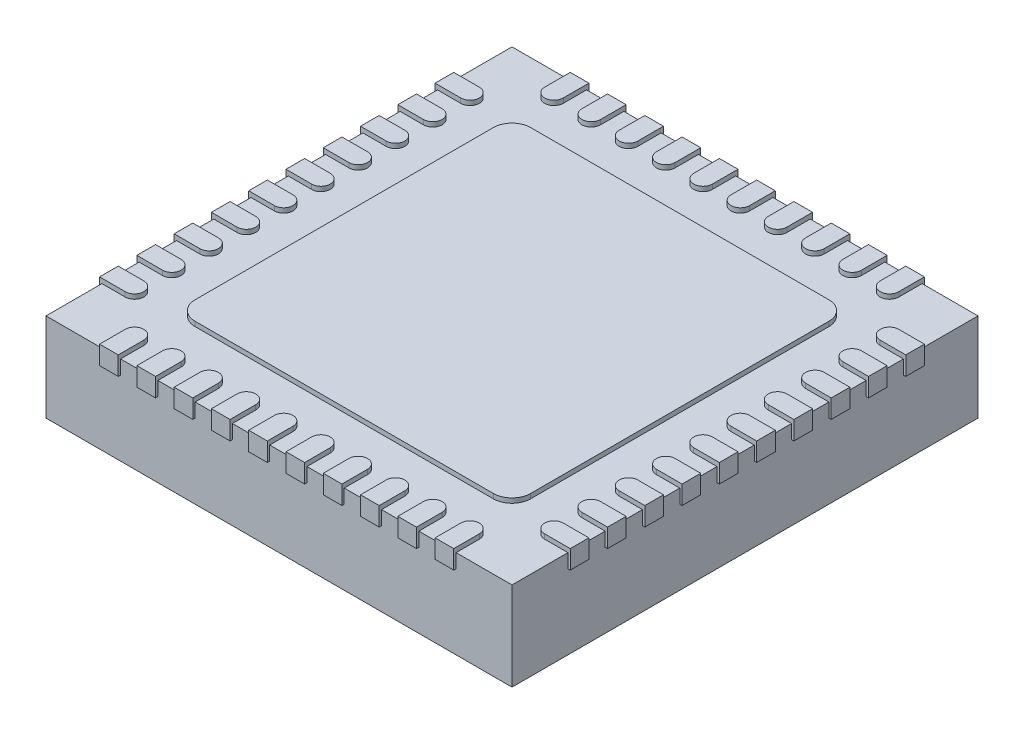
from build123d import *

# Parameters (mm, degrees)
SKETCH3_W                = 5
SKETCH3_H                = 5
BOSS_EXTRUDE2_DEPTH      = 0.95
BOSS_EXTRUDE3_DEPTH      = 0.05
BOSS_EXTRUDE3_DEPTH_BACK = 0.15
SKETCH7_R                = 0.3
CUT_EXTRUDE3_DEPTH       = 0.1
ENL_V_MAT_EXTRU_1_DEPTH  = 0.1


with BuildPart() as part:
    # Sketch3 → Boss-Extrude2 (new body)
    with BuildSketch(Plane(origin=(0, 0, 0), x_dir=(1, 0, 0), z_dir=(0, 1, 0))):
        Rectangle(SKETCH3_W, SKETCH3_H)
    extrude(amount=-BOSS_EXTRUDE2_DEPTH)

    # Sketch2 → Boss-Extrude3 (add, two sides: drawn at the far end of the back side and taken through both)
    with BuildSketch(Plane(origin=(0, 0, 0), x_dir=(1, 0, 0), z_dir=(0, 1, 0)).offset(-BOSS_EXTRUDE3_DEPTH_BACK)):
        with BuildLine():
            Line((-1.6, -1.8), (1.6, -1.8))
            ThreePointArc((1.6, -1.8), (1.741421356, -1.741421356), (1.8, -1.6))
            Line((1.8, -1.6), (1.8, 1.6))
            ThreePointArc((1.8, 1.6), (1.741421356, 1.741421356), (1.6, 1.8))
            Line((1.6, 1.8), (-1.6, 1.8))
            ThreePointArc((-1.6, 1.8), (-1.741421356, 1.741421356), (-1.8, 1.6))
            Line((-1.8, 1.6), (-1.8, -1.6))
            ThreePointArc((-1.8, -1.6), (-1.741421356, -1.741421356), (-1.6, -1.8))
        make_face()
        with BuildLine():
            Line((-1.9, -2.25), (-1.9, -2.525))
            Line((-1.9, -2.525), (-1.7, -2.525))
            Line((-1.7, -2.525), (-1.7, -2.25))
            ThreePointArc((-1.7, -2.25), (-1.8, -2.15), (-1.9, -2.25))
        make_face()
        with BuildLine():
            Line((1.3, -2.25), (1.3, -2.525))
            Line((1.3, -2.525), (1.5, -2.525))
            Line((1.5, -2.525), (1.5, -2.25))
            ThreePointArc((1.5, -2.25), (1.4, -2.15), (1.3, -2.25))
        make_face()
        with BuildLine():
            Line((-1.9, 2.25), (-1.9, 2.525))
            Line((-1.9, 2.525), (-1.7, 2.525))
            Line((-1.7, 2.525), (-1.7, 2.25))
            ThreePointArc((-1.7, 2.25), (-1.8, 2.15), (-1.9, 2.25))
        make_face()
        with BuildLine():
            Line((-1.5, -2.25), (-1.5, -2.525))
            Line((-1.5, -2.525), (-1.3, -2.525))
            Line((-1.3, -2.525), (-1.3, -2.25))
            ThreePointArc((-1.3, -2.25), (-1.4, -2.15), (-1.5, -2.25))
        make_face()
        with BuildLine():
            Line((-1.3, 2.525), (-1.3, 2.25))
            ThreePointArc((-1.3, 2.25), (-1.4, 2.15), (-1.5, 2.25))
            Line((-1.5, 2.25), (-1.5, 2.525))
            Line((-1.5, 2.525), (-1.3, 2.525))
        make_face()
        with BuildLine():
            Line((-1.1, -2.25), (-1.1, -2.525))
            Line((-1.1, -2.525), (-0.9, -2.525))
            Line((-0.9, -2.525), (-0.9, -2.25))
            ThreePointArc((-0.9, -2.25), (-1, -2.15), (-1.1, -2.25))
        make_face()
        with BuildLine():
            Line((-0.9, 2.525), (-0.9, 2.25))
            ThreePointArc((-0.9, 2.25), (-1, 2.15), (-1.1, 2.25))
            Line((-1.1, 2.25), (-1.1, 2.525))
            Line((-1.1, 2.525), (-0.9, 2.525))
        make_face()
        with BuildLine():
            Line((-0.7, -2.25), (-0.7, -2.525))
            Line((-0.7, -2.525), (-0.5, -2.525))
            Line((-0.5, -2.525), (-0.5, -2.25))
            ThreePointArc((-0.5, -2.25), (-0.6, -2.15), (-0.7, -2.25))
        make_face()
        with BuildLine():
            Line((-0.5, 2.525), (-0.5, 2.25))
            ThreePointArc((-0.5, 2.25), (-0.6, 2.15), (-0.7, 2.25))
            Line((-0.7, 2.25), (-0.7, 2.525))
            Line((-0.7, 2.525), (-0.5, 2.525))
        make_face()
        with BuildLine():
            Line((-0.3, -2.25), (-0.3, -2.525))
            Line((-0.3, -2.525), (-0.1, -2.525))
            Line((-0.1, -2.525), (-0.1, -2.25))
            ThreePointArc((-0.1, -2.25), (-0.2, -2.15), (-0.3, -2.25))
        make_face()
        with BuildLine():
            Line((-0.1, 2.525), (-0.1, 2.25))
            ThreePointArc((-0.1, 2.25), (-0.2, 2.15), (-0.3, 2.25))
            Line((-0.3, 2.25), (-0.3, 2.525))
            Line((-0.3, 2.525), (-0.1, 2.525))
        make_face()
        with BuildLine():
            Line((0.1, -2.25), (0.1, -2.525))
            Line((0.1, -2.525), (0.3, -2.525))
            Line((0.3, -2.525), (0.3, -2.25))
            ThreePointArc((0.3, -2.25), (0.2, -2.15), (0.1, -2.25))
        make_face()
        with BuildLine():
            Line((0.3, 2.525), (0.3, 2.25))
            ThreePointArc((0.3, 2.25), (0.2, 2.15), (0.1, 2.25))
            Line((0.1, 2.25), (0.1, 2.525))
            Line((0.1, 2.525), (0.3, 2.525))
        make_face()
        with BuildLine():
            Line((0.5, -2.25), (0.5, -2.525))
            Line((0.5, -2.525), (0.7, -2.525))
            Line((0.7, -2.525), (0.7, -2.25))
            ThreePointArc((0.7, -2.25), (0.6, -2.15), (0.5, -2.25))
        make_face()
        with BuildLine():
            Line((0.7, 2.525), (0.7, 2.25))
            ThreePointArc((0.7, 2.25), (0.6, 2.15), (0.5, 2.25))
            Line((0.5, 2.25), (0.5, 2.525))
            Line((0.5, 2.525), (0.7, 2.525))
        make_face()
        with BuildLine():
            Line((0.9, -2.25), (0.9, -2.525))
            Line((0.9, -2.525), (1.1, -2.525))
            Line((1.1, -2.525), (1.1, -2.25))
            ThreePointArc((1.1, -2.25), (1, -2.15), (0.9, -2.25))
        make_face()
        with BuildLine():
            Line((1.1, 2.525), (1.1, 2.25))
            ThreePointArc((1.1, 2.25), (1, 2.15), (0.9, 2.25))
            Line((0.9, 2.25), (0.9, 2.525))
            Line((0.9, 2.525), (1.1, 2.525))
        make_face()
        with BuildLine():
            Line((-2.525, -1.9), (-2.25, -1.9))
            ThreePointArc((-2.25, -1.9), (-2.15, -1.8), (-2.25, -1.7))
            Line((-2.25, -1.7), (-2.525, -1.7))
            Line((-2.525, -1.7), (-2.525, -1.9))
        make_face()
        with BuildLine():
            Line((1.5, 2.525), (1.5, 2.25))
            ThreePointArc((1.5, 2.25), (1.4, 2.15), (1.3, 2.25))
            Line((1.3, 2.25), (1.3, 2.525))
            Line((1.3, 2.525), (1.5, 2.525))
        make_face()
        with BuildLine():
            Line((2.25, -1.9), (2.525, -1.9))
            Line((2.525, -1.9), (2.525, -1.7))
            Line((2.525, -1.7), (2.25, -1.7))
            ThreePointArc((2.25, -1.7), (2.15, -1.8), (2.25, -1.9))
        make_face()
        with BuildLine():
            Line((-2.25, -1.3), (-2.525, -1.3))
            Line((-2.525, -1.3), (-2.525, -1.5))
            Line((-2.525, -1.5), (-2.25, -1.5))
            ThreePointArc((-2.25, -1.5), (-2.15, -1.4), (-2.25, -1.3))
        make_face()
        with BuildLine():
            Line((2.25, -1.5), (2.525, -1.5))
            Line((2.525, -1.5), (2.525, -1.3))
            Line((2.525, -1.3), (2.25, -1.3))
            ThreePointArc((2.25, -1.3), (2.15, -1.4), (2.25, -1.5))
        make_face()
        with BuildLine():
            Line((-2.25, -0.9), (-2.525, -0.9))
            Line((-2.525, -0.9), (-2.525, -1.1))
            Line((-2.525, -1.1), (-2.25, -1.1))
            ThreePointArc((-2.25, -1.1), (-2.15, -1), (-2.25, -0.9))
        make_face()
        with BuildLine():
            Line((2.25, -1.1), (2.525, -1.1))
            Line((2.525, -1.1), (2.525, -0.9))
            Line((2.525, -0.9), (2.25, -0.9))
            ThreePointArc((2.25, -0.9), (2.15, -1), (2.25, -1.1))
        make_face()
        with BuildLine():
            Line((-2.25, -0.5), (-2.525, -0.5))
            Line((-2.525, -0.5), (-2.525, -0.7))
            Line((-2.525, -0.7), (-2.25, -0.7))
            ThreePointArc((-2.25, -0.7), (-2.15, -0.6), (-2.25, -0.5))
        make_face()
        with BuildLine():
            Line((2.25, -0.7), (2.525, -0.7))
            Line((2.525, -0.7), (2.525, -0.5))
            Line((2.525, -0.5), (2.25, -0.5))
            ThreePointArc((2.25, -0.5), (2.15, -0.6), (2.25, -0.7))
        make_face()
        with BuildLine():
            Line((-2.25, -0.1), (-2.525, -0.1))
            Line((-2.525, -0.1), (-2.525, -0.3))
            Line((-2.525, -0.3), (-2.25, -0.3))
            ThreePointArc((-2.25, -0.3), (-2.15, -0.2), (-2.25, -0.1))
        make_face()
        with BuildLine():
            Line((2.25, -0.3), (2.525, -0.3))
            Line((2.525, -0.3), (2.525, -0.1))
            Line((2.525, -0.1), (2.25, -0.1))
            ThreePointArc((2.25, -0.1), (2.15, -0.2), (2.25, -0.3))
        make_face()
        with BuildLine():
            Line((-2.25, 0.3), (-2.525, 0.3))
            Line((-2.525, 0.3), (-2.525, 0.1))
            Line((-2.525, 0.1), (-2.25, 0.1))
            ThreePointArc((-2.25, 0.1), (-2.15, 0.2), (-2.25, 0.3))
        make_face()
        with BuildLine():
            Line((2.25, 0.1), (2.525, 0.1))
            Line((2.525, 0.1), (2.525, 0.3))
            Line((2.525, 0.3), (2.25, 0.3))
            ThreePointArc((2.25, 0.3), (2.15, 0.2), (2.25, 0.1))
        make_face()
        with BuildLine():
            Line((-2.25, 0.7), (-2.525, 0.7))
            Line((-2.525, 0.7), (-2.525, 0.5))
            Line((-2.525, 0.5), (-2.25, 0.5))
            ThreePointArc((-2.25, 0.5), (-2.15, 0.6), (-2.25, 0.7))
        make_face()
        with BuildLine():
            Line((2.25, 0.5), (2.525, 0.5))
            Line((2.525, 0.5), (2.525, 0.7))
            Line((2.525, 0.7), (2.25, 0.7))
            ThreePointArc((2.25, 0.7), (2.15, 0.6), (2.25, 0.5))
        make_face()
        with BuildLine():
            Line((-2.25, 1.1), (-2.525, 1.1))
            Line((-2.525, 1.1), (-2.525, 0.9))
            Line((-2.525, 0.9), (-2.25, 0.9))
            ThreePointArc((-2.25, 0.9), (-2.15, 1), (-2.25, 1.1))
        make_face()
        with BuildLine():
            Line((2.25, 0.9), (2.525, 0.9))
            Line((2.525, 0.9), (2.525, 1.1))
            Line((2.525, 1.1), (2.25, 1.1))
            ThreePointArc((2.25, 1.1), (2.15, 1), (2.25, 0.9))
        make_face()
        with BuildLine():
            Line((1.7, -2.25), (1.7, -2.525))
            Line((1.7, -2.525), (1.9, -2.525))
            Line((1.9, -2.525), (1.9, -2.25))
            ThreePointArc((1.9, -2.25), (1.8, -2.15), (1.7, -2.25))
        make_face()
        with BuildLine():
            Line((1.9, 2.525), (1.9, 2.25))
            ThreePointArc((1.9, 2.25), (1.8, 2.15), (1.7, 2.25))
            Line((1.7, 2.25), (1.7, 2.525))
            Line((1.7, 2.525), (1.9, 2.525))
        make_face()
        with BuildLine():
            Line((-2.25, 1.5), (-2.525, 1.5))
            Line((-2.525, 1.5), (-2.525, 1.3))
            Line((-2.525, 1.3), (-2.25, 1.3))
            ThreePointArc((-2.25, 1.3), (-2.15, 1.4), (-2.25, 1.5))
        make_face()
        with BuildLine():
            Line((2.25, 1.3), (2.525, 1.3))
            Line((2.525, 1.3), (2.525, 1.5))
            Line((2.525, 1.5), (2.25, 1.5))
            ThreePointArc((2.25, 1.5), (2.15, 1.4), (2.25, 1.3))
        make_face()
        with BuildLine():
            Line((-2.25, 1.9), (-2.525, 1.9))
            Line((-2.525, 1.9), (-2.525, 1.7))
            Line((-2.525, 1.7), (-2.25, 1.7))
            ThreePointArc((-2.25, 1.7), (-2.15, 1.8), (-2.25, 1.9))
        make_face()
        with BuildLine():
            Line((2.25, 1.7), (2.525, 1.7))
            Line((2.525, 1.7), (2.525, 1.9))
            Line((2.525, 1.9), (2.25, 1.9))
            ThreePointArc((2.25, 1.9), (2.15, 1.8), (2.25, 1.7))
        make_face()
    extrude(amount=BOSS_EXTRUDE3_DEPTH + BOSS_EXTRUDE3_DEPTH_BACK)

    # Sketch7 → Cut-Extrude3 (cut)
    with BuildSketch(Plane.XZ.offset(0.95)):
        with Locations(Location((2.05, -2.05, 0), (0, 0, 270))):
            Circle(SKETCH7_R)
    extrude(amount=-CUT_EXTRUDE3_DEPTH, mode=Mode.SUBTRACT)

    # Esquisse1 → Enlèv. mat.-Extru.1 (cut)
    # profile 1 of 7: a face of its own
    with BuildSketch(Plane(origin=(0, -0.95, 0), x_dir=(-1, 0, 0), z_dir=(0, -1, 0))):
        with BuildLine():
            Line((-1.864407441, 0.657456142), (-1.705562038, 0.657456142))
            add(Edge.make_bspline(
                [(-1.705562038, 0.657456142), (-1.694961818, 0.657420858), (-1.674608221, 0.657353107), (-1.64544964, 0.656975336), (-1.618954923, 0.65589258), (-1.595137924, 0.654960812), (-1.573999079, 0.653261747), (-1.555473569, 0.651637815), (-1.539646716, 0.649512002), (-1.53006596, 0.647537737), (-1.525728054, 0.646643843)],
                knots=[0, 0, 0, 0, 1.410062039, 2.707475311, 3.878576406, 4.937260626, 5.877586885, 6.699081471, 7.410979367, 8, 8, 8, 8], degree=3))
            add(Edge.make_bspline(
                [(-1.525728054, 0.646643843), (-1.519920837, 0.645209023), (-1.508430288, 0.642369991), (-1.491886255, 0.636369332), (-1.4761214, 0.629425238), (-1.461201207, 0.62126918), (-1.447200412, 0.611840614), (-1.433974652, 0.601302308), (-1.421463913, 0.589711924), (-1.41017415, 0.576777237), (-1.399529044, 0.563207171), (-1.390550909, 0.548533283), (-1.382811511, 0.533188615), (-1.376649626, 0.517017112), (-1.371688014, 0.500175603), (-1.368189563, 0.482511536), (-1.366091526, 0.464105387), (-1.365877927, 0.451551004), (-1.36576962, 0.445185259)],
                knots=[0, 0, 0, 0, 1.027469482, 2.033020251, 3.019912614, 3.986113645, 4.951240523, 5.91722682, 6.890402269, 7.87763091, 8.8651537, 9.85103654, 10.82876324, 11.815024772, 12.821070561, 13.842952187, 14.906261191, 16, 16, 16, 16], degree=3))
            add(Edge.make_bspline(
                [(-1.36576962, 0.445185259), (-1.366102768, 0.434609084), (-1.366752826, 0.413972226), (-1.372813698, 0.384022705), (-1.382741587, 0.356085128), (-1.396422047, 0.330194672), (-1.413843607, 0.306856008), (-1.43478155, 0.286356744), (-1.459247559, 0.269202693), (-1.482023493, 0.257307146), (-1.502142606, 0.249688754), (-1.518705518, 0.244328366), (-1.53677285, 0.240186813), (-1.556171496, 0.236476569), (-1.576982182, 0.233675381), (-1.59915503, 0.231623742), (-1.622705854, 0.230341485), (-1.638884536, 0.23015053), (-1.647207421, 0.230052296)],
                knots=[0, 0, 0, 0, 1.260483769, 2.459530307, 3.627416485, 4.787058657, 5.939039949, 7.08810263, 8.267026773, 9.491475466, 10.141966685, 10.831826277, 11.566392101, 12.351337768, 13.187381173, 14.07005841, 15.007169909, 16, 16, 16, 16], degree=3))
            Line((-1.647207421, 0.230052296), (-1.355593338, -0.136293858))
            Line((-1.355593338, -0.136293858), (-1.44368178, -0.136293858))
            Line((-1.44368178, -0.136293858), (-1.735295862, 0.230052296))
            Line((-1.735295862, 0.230052296), (-1.793173467, 0.230052296))
            Line((-1.793173467, 0.230052296), (-1.793173467, -0.136293858))
            Line((-1.793173467, -0.136293858), (-1.864407441, -0.136293858))
            Line((-1.864407441, -0.136293858), (-1.864407441, 0.657456142))
        make_face()
        with BuildLine():
            Line((-1.793173467, 0.576045886), (-1.793173467, 0.311462553))
            Line((-1.793173467, 0.311462553), (-1.647843439, 0.310349522))
            add(Edge.make_bspline(
                [(-1.647843439, 0.310349522), (-1.641058001, 0.31034652), (-1.627905891, 0.310340701), (-1.608878419, 0.311246433), (-1.591161893, 0.312276793), (-1.57482408, 0.313852805), (-1.55985768, 0.315883914), (-1.546270174, 0.318424591), (-1.534039381, 0.321384612), (-1.519774891, 0.325966052), (-1.50384625, 0.33322456), (-1.486535365, 0.34378495), (-1.471793763, 0.357067589), (-1.459339177, 0.372256212), (-1.449331252, 0.388955862), (-1.442275483, 0.40696636), (-1.437798179, 0.425833026), (-1.437270098, 0.438800204), (-1.437003595, 0.445344263)],
                knots=[0, 0, 0, 0, 1.146690395, 2.22261258, 3.21895312, 4.145990853, 4.996080663, 5.770904154, 6.481378293, 7.121626537, 8.300444488, 9.431385265, 10.535395872, 11.636531494, 12.74115979, 13.810798291, 14.895190096, 16, 16, 16, 16], degree=3))
            add(Edge.make_bspline(
                [(-1.437003595, 0.445344263), (-1.437276219, 0.451727504), (-1.43781646, 0.464376758), (-1.442227163, 0.482895152), (-1.449686004, 0.500372836), (-1.459737655, 0.51673871), (-1.471983892, 0.531594475), (-1.486343467, 0.544305169), (-1.502423752, 0.554793887), (-1.517453114, 0.561496398), (-1.530886587, 0.565605722), (-1.542550099, 0.568497504), (-1.555728952, 0.570820803), (-1.570487136, 0.572682274), (-1.586761649, 0.574282234), (-1.604634779, 0.57535987), (-1.623987941, 0.575998014), (-1.63740162, 0.576029557), (-1.644345342, 0.576045886)],
                knots=[0, 0, 0, 0, 1.101028733, 2.181837193, 3.264309656, 4.369019818, 5.486613113, 6.575447106, 7.666700264, 8.788928104, 9.402425223, 10.0903467, 10.862060571, 11.710948788, 12.657782767, 13.684531032, 14.801375019, 16, 16, 16, 16], degree=3))
            Line((-1.644345342, 0.576045886), (-1.793173467, 0.576045886))
        make_face(mode=Mode.SUBTRACT)
    # profile 2 of 7: a face of its own
    with BuildSketch(Plane(origin=(0, -0.95, 0), x_dir=(-1, 0, 0), z_dir=(0, -1, 0))):
        Polygon((-1.284359364, 0.576045886), (-1.284359364, 0.657456142), (-0.8671318, 0.657456142), (-0.8671318, 0.576045886), (-1.040128595, 0.576045886), (-1.040128595, -0.136293858), (-1.111362569, -0.136293858), (-1.111362569, 0.576045886), align=None)
    # profile 3 of 7: a face of its own
    with BuildSketch(Plane(origin=(0, -0.95, 0), x_dir=(-1, 0, 0), z_dir=(0, -1, 0))):
        Polygon((-0.745016415, 0.657456142), (-0.673782441, 0.657456142), (-0.673782441, -0.054883601), (-0.368493979, -0.054883601), (-0.368493979, -0.136293858), (-0.745016415, -0.136293858), align=None)
    # profile 4 of 7: a face of its own
    with BuildSketch(Plane(origin=(0, -0.95, 0), x_dir=(-1, 0, 0), z_dir=(0, -1, 0))):
        with BuildLine():
            add(Edge.make_bspline(
                [(0.078467409, 0.305897398), (0.08496449, 0.302509683), (0.097635968, 0.295902508), (0.115682942, 0.285263802), (0.132175934, 0.274051298), (0.147572543, 0.262794594), (0.161602267, 0.251062594), (0.174108232, 0.238808646), (0.185399353, 0.22633862), (0.195247928, 0.213441352), (0.203910424, 0.200151109), (0.211397105, 0.186433006), (0.217796364, 0.172317107), (0.222867959, 0.157649326), (0.227045758, 0.142645123), (0.229920404, 0.12711076), (0.231466384, 0.111148597), (0.231758668, 0.100360785), (0.231906662, 0.09489855)],
                knots=[0, 0, 0, 0, 1.272397273, 2.481599622, 3.635517121, 4.734568067, 5.792894095, 6.808321871, 7.773003508, 8.711915296, 9.623354172, 10.525449501, 11.423591555, 12.311487226, 13.218079475, 14.126165749, 15.051214107, 16, 16, 16, 16], degree=3))
            add(Edge.make_bspline(
                [(0.231906662, 0.09489855), (0.231731714, 0.087256386), (0.231385428, 0.072129675), (0.228369182, 0.049803504), (0.223853203, 0.028120117), (0.217258385, 0.00708427), (0.208705527, -0.013187963), (0.198165244, -0.032713934), (0.186233775, -0.051813671), (0.17665157, -0.063565571), (0.171802996, -0.069512007)],
                knots=[0, 0, 0, 0, 1.025265484, 2.029385089, 3.018602448, 3.995076438, 4.983346944, 5.966715145, 6.97116228, 8, 8, 8, 8], degree=3))
            add(Edge.make_bspline(
                [(0.171802996, -0.069512007), (0.165490081, -0.076450237), (0.152942262, -0.090240962), (0.131446848, -0.108145878), (0.107856171, -0.123192972), (0.082261513, -0.135455706), (0.054731292, -0.145000177), (0.025271373, -0.151858748), (-0.006175676, -0.155787228), (-0.027789595, -0.156355097), (-0.038877844, -0.156646422)],
                knots=[0, 0, 0, 0, 0.954267603, 1.896743057, 2.838368354, 3.796610408, 4.779680527, 5.799409237, 6.871065594, 8, 8, 8, 8], degree=3))
            add(Edge.make_bspline(
                [(-0.038877844, -0.156646422), (-0.049539809, -0.156385056), (-0.070286909, -0.155876465), (-0.100485214, -0.152430585), (-0.128634553, -0.146391766), (-0.154898599, -0.138126649), (-0.179119017, -0.127374686), (-0.201226792, -0.113992422), (-0.221540889, -0.098518506), (-0.239444821, -0.080508527), (-0.255339879, -0.061218617), (-0.269302634, -0.041317806), (-0.280908184, -0.020804276), (-0.29073415, 1.6096e-05), (-0.298256184, 0.021435135), (-0.303465953, 0.043342638), (-0.306774601, 0.06570034), (-0.307214823, 0.080788768), (-0.307436287, 0.08837937)],
                knots=[0, 0, 0, 0, 1.256902934, 2.445805442, 3.576955095, 4.645999104, 5.686449165, 6.692658513, 7.68621702, 8.689161843, 9.678783111, 10.630372946, 11.551080876, 12.453998257, 13.34127905, 14.221779781, 15.105423033, 16, 16, 16, 16], degree=3))
            add(Edge.make_bspline(
                [(-0.307436287, 0.08837937), (-0.307305232, 0.093949044), (-0.307046221, 0.104956685), (-0.305253514, 0.121219336), (-0.302371417, 0.137048103), (-0.298457218, 0.15250145), (-0.293152468, 0.167466874), (-0.286747555, 0.182015285), (-0.279279059, 0.196163108), (-0.270642795, 0.209987711), (-0.260595729, 0.223295386), (-0.249219329, 0.236311978), (-0.236286224, 0.248835508), (-0.22194029, 0.261018987), (-0.206345475, 0.273078538), (-0.189096714, 0.284362426), (-0.170651264, 0.295669501), (-0.157541823, 0.302429603), (-0.150816946, 0.305897398)],
                knots=[0, 0, 0, 0, 0.941657376, 1.861047343, 2.762797495, 3.66048619, 4.553285746, 5.444104102, 6.34607688, 7.256116206, 8.197091036, 9.162375105, 10.176350973, 11.237807142, 12.343728897, 13.50695164, 14.721116704, 16, 16, 16, 16], degree=3))
            add(Edge.make_bspline(
                [(-0.150816946, 0.305897398), (-0.16002249, 0.310917248), (-0.177847, 0.320637081), (-0.201448462, 0.338495732), (-0.221720979, 0.35783779), (-0.238107316, 0.37907169), (-0.251005125, 0.401534106), (-0.259853987, 0.425084499), (-0.265840333, 0.449286189), (-0.266433338, 0.465820273), (-0.266731159, 0.474124061)],
                knots=[0, 0, 0, 0, 1.166880483, 2.259407225, 3.286803203, 4.280235371, 5.237608625, 6.161067461, 7.076446754, 8, 8, 8, 8], degree=3))
            add(Edge.make_bspline(
                [(-0.266731159, 0.474124061), (-0.266360268, 0.482582615), (-0.265614713, 0.499585782), (-0.259585996, 0.524896456), (-0.249761623, 0.549755927), (-0.236399183, 0.574043705), (-0.219756011, 0.596937772), (-0.199788312, 0.617471165), (-0.176972921, 0.635457876), (-0.151423726, 0.650556401), (-0.12392908, 0.662844481), (-0.094919621, 0.671321373), (-0.064900792, 0.676863135), (-0.044467916, 0.677490573), (-0.034107711, 0.677808707)],
                knots=[0, 0, 0, 0, 0.888701115, 1.786444228, 2.72001202, 3.692817113, 4.693886446, 5.687152267, 6.695133018, 7.739871481, 8.800368666, 9.853104506, 10.91144658, 12, 12, 12, 12], degree=3))
            add(Edge.make_bspline(
                [(-0.034107711, 0.677808707), (-0.024014882, 0.677480697), (-0.004112972, 0.676833898), (0.025141167, 0.671439374), (0.053132166, 0.662429287), (0.079763499, 0.650206166), (0.104558404, 0.635150557), (0.126466428, 0.616916787), (0.145818638, 0.596473971), (0.161826171, 0.573586847), (0.175016683, 0.549392396), (0.184201709, 0.524078003), (0.190087246, 0.498190627), (0.190829598, 0.480674151), (0.191201533, 0.471897999)],
                knots=[0, 0, 0, 0, 1.072916533, 2.115669174, 3.151510826, 4.193348718, 5.225979165, 6.227137561, 7.216255879, 8.211077061, 9.189680878, 10.138522389, 11.067357538, 12, 12, 12, 12], degree=3))
            add(Edge.make_bspline(
                [(0.191201533, 0.471897999), (0.190876196, 0.463285435), (0.19023725, 0.446370847), (0.184862443, 0.421713225), (0.175810673, 0.398621441), (0.163452176, 0.376833468), (0.14734461, 0.35674445), (0.127702986, 0.338098929), (0.104683901, 0.320743738), (0.087389022, 0.310949687), (0.078467409, 0.305897398)],
                knots=[0, 0, 0, 0, 0.975232327, 1.915300861, 2.843280834, 3.77672583, 4.742871857, 5.749627742, 6.839139064, 8, 8, 8, 8], degree=3))
        make_face()
        with BuildLine():
            add(Edge.make_bspline(
                [(-0.038082822, 0.59639845), (-0.043650594, 0.596250713), (-0.05454359, 0.595961674), (-0.070515807, 0.59445159), (-0.085704183, 0.591513986), (-0.100267409, 0.587604492), (-0.114005818, 0.582323109), (-0.127105994, 0.576110312), (-0.139344982, 0.568556972), (-0.150870527, 0.560083986), (-0.161246149, 0.550764702), (-0.170454682, 0.541055163), (-0.178103736, 0.530764672), (-0.184599131, 0.520149205), (-0.189312082, 0.508893699), (-0.192841844, 0.497343236), (-0.195227945, 0.485351854), (-0.19540674, 0.47715661), (-0.195497185, 0.47301103)],
                knots=[0, 0, 0, 0, 1.203892937, 2.355340988, 3.463153438, 4.544400666, 5.610487187, 6.640501085, 7.674077295, 8.714426146, 9.728707835, 10.68524104, 11.601827946, 12.495867327, 13.368432065, 14.231010473, 15.105153427, 16, 16, 16, 16], degree=3))
            add(Edge.make_bspline(
                [(-0.195497185, 0.47301103), (-0.1953413, 0.468865272), (-0.195033248, 0.460672658), (-0.192650835, 0.448574577), (-0.189100084, 0.436686099), (-0.183509667, 0.42528991), (-0.176804439, 0.413990684), (-0.168528693, 0.403070819), (-0.158666003, 0.392492312), (-0.14754728, 0.382345139), (-0.135434306, 0.372843098), (-0.122601854, 0.36459418), (-0.109210976, 0.357692159), (-0.095399256, 0.351947811), (-0.08102593, 0.347482415), (-0.066179069, 0.344314525), (-0.050856178, 0.342345573), (-0.040473797, 0.342110391), (-0.035220742, 0.341991399)],
                knots=[0, 0, 0, 0, 0.873023192, 1.725219244, 2.590779336, 3.480155217, 4.391973325, 5.357036234, 6.360879153, 7.436073238, 8.526419356, 9.601555421, 10.645666583, 11.697338044, 12.750135903, 13.812665442, 14.89329948, 16, 16, 16, 16], degree=3))
            add(Edge.make_bspline(
                [(-0.035220742, 0.341991399), (-0.028473844, 0.342189353), (-0.015046685, 0.342583305), (0.00474702, 0.346246161), (0.023992656, 0.35200786), (0.042484514, 0.359890924), (0.059743947, 0.369785099), (0.075129105, 0.381630801), (0.088508758, 0.395154509), (0.099743861, 0.410145688), (0.108454665, 0.426100423), (0.115235968, 0.442111561), (0.119195922, 0.458349924), (0.119712442, 0.469228146), (0.119967559, 0.474601074)],
                knots=[0, 0, 0, 0, 1.076279235, 2.141928126, 3.20205304, 4.278698113, 5.344010996, 6.36967002, 7.368914609, 8.37248503, 9.349703398, 10.264243087, 11.142681841, 12, 12, 12, 12], degree=3))
            add(Edge.make_bspline(
                [(0.119967559, 0.474601074), (0.119846932, 0.478372075), (0.119607505, 0.485856972), (0.117634457, 0.496910137), (0.114374223, 0.507711846), (0.109960275, 0.518351332), (0.104152339, 0.52867932), (0.097266175, 0.538858163), (0.088901297, 0.548658881), (0.079513178, 0.558309871), (0.06886663, 0.567241605), (0.056982171, 0.575096263), (0.043920731, 0.581766565), (0.029682001, 0.587184193), (0.01431842, 0.591253262), (-0.002099249, 0.594300434), (-0.019707901, 0.596017907), (-0.031825005, 0.596268851), (-0.038082822, 0.59639845)],
                knots=[0, 0, 0, 0, 0.814439003, 1.616544685, 2.417341072, 3.248991801, 4.09997495, 4.973547432, 5.9003056, 6.880240646, 7.880314356, 8.896779544, 9.951930927, 11.043077905, 12.18215768, 13.381699519, 14.647792085, 16, 16, 16, 16], degree=3))
        make_face(mode=Mode.SUBTRACT)
        with BuildLine():
            add(Edge.make_bspline(
                [(-0.033471694, 0.260581142), (-0.040530577, 0.260455585), (-0.054378384, 0.26020927), (-0.074665938, 0.257467544), (-0.094136209, 0.253650879), (-0.112723552, 0.247860849), (-0.130420117, 0.240332359), (-0.147321704, 0.231275776), (-0.163299013, 0.220570256), (-0.178131417, 0.208351809), (-0.191675815, 0.195184755), (-0.203559001, 0.18124602), (-0.213650403, 0.16679466), (-0.221776873, 0.151647137), (-0.228447033, 0.136124196), (-0.232827145, 0.11983926), (-0.23563514, 0.103105397), (-0.236012201, 0.091729803), (-0.236202313, 0.085994304)],
                knots=[0, 0, 0, 0, 1.140299081, 2.23698856, 3.303958914, 4.344563908, 5.37730929, 6.408454204, 7.439741482, 8.480804886, 9.510774543, 10.48932336, 11.43758569, 12.353841022, 13.263987381, 14.161954604, 15.073269652, 16, 16, 16, 16], degree=3))
            add(Edge.make_bspline(
                [(-0.236202313, 0.085994304), (-0.235893145, 0.078866223), (-0.235279764, 0.064724278), (-0.230413705, 0.04382301), (-0.222604217, 0.023588949), (-0.211712784, 0.004186989), (-0.198226388, -0.013944553), (-0.18164235, -0.029748972), (-0.162991303, -0.043791879), (-0.141642182, -0.055149428), (-0.118322155, -0.06421969), (-0.093037424, -0.070468989), (-0.066150862, -0.074605889), (-0.047586276, -0.075022762), (-0.038082822, -0.075236165)],
                knots=[0, 0, 0, 0, 0.898778495, 1.783155532, 2.693654817, 3.627872908, 4.583023416, 5.533784346, 6.509005473, 7.520592997, 8.575161974, 9.658835044, 10.801527049, 12, 12, 12, 12], degree=3))
            add(Edge.make_bspline(
                [(-0.038082822, -0.075236165), (-0.030655506, -0.07509356), (-0.016184713, -0.074815721), (0.00492585, -0.072363193), (0.024847739, -0.068473903), (0.04354232, -0.062817063), (0.061218869, -0.055911444), (0.077577683, -0.047027775), (0.093039599, -0.036923945), (0.106842713, -0.02493647), (0.119414173, -0.012127728), (0.130375473, 0.0014318), (0.139890846, 0.015373595), (0.147359116, 0.030012723), (0.153329535, 0.045068327), (0.157621127, 0.060679238), (0.160269125, 0.076893335), (0.160536936, 0.087892231), (0.160672687, 0.093467511)],
                knots=[0, 0, 0, 0, 1.224942928, 2.386581632, 3.501229538, 4.569074225, 5.605009692, 6.626002462, 7.634866581, 8.645888296, 9.63523824, 10.59253846, 11.518950513, 12.414518923, 13.29783783, 14.186679152, 15.080837789, 16, 16, 16, 16], degree=3))
            add(Edge.make_bspline(
                [(0.160672687, 0.093467511), (0.160467254, 0.09888255), (0.160062175, 0.109560063), (0.157491175, 0.125382114), (0.152974539, 0.14066811), (0.146777075, 0.15560195), (0.138526393, 0.169881048), (0.128809788, 0.183877394), (0.117086301, 0.197202516), (0.103839158, 0.209959915), (0.089402216, 0.221756341), (0.074056274, 0.232191758), (0.057919458, 0.240980185), (0.041025916, 0.248127676), (0.023413158, 0.25374912), (0.005094138, 0.25767614), (-0.01395259, 0.260148014), (-0.02689182, 0.260435135), (-0.033471694, 0.260581142)],
                knots=[0, 0, 0, 0, 0.917430815, 1.809013306, 2.70690318, 3.612392954, 4.541220862, 5.495268465, 6.494511384, 7.542276156, 8.608045339, 9.649016899, 10.681629292, 11.715607085, 12.752076957, 13.808767841, 14.885711793, 16, 16, 16, 16], degree=3))
        make_face(mode=Mode.SUBTRACT)
    # profile 5 of 7: a face of its own
    with BuildSketch(Plane(origin=(0, -0.95, 0), x_dir=(-1, 0, 0), z_dir=(0, -1, 0))):
        with BuildLine():
            Line((0.404903456, 0.413225373), (0.333669482, 0.413225373))
            add(Edge.make_bspline(
                [(0.333669482, 0.413225373), (0.334133747, 0.422675735), (0.335045551, 0.441235995), (0.339315538, 0.468296952), (0.345425344, 0.494162951), (0.354063942, 0.518626307), (0.36479233, 0.541903322), (0.37765789, 0.56390154), (0.392896495, 0.584537041), (0.410179094, 0.603618529), (0.428949839, 0.621123568), (0.44920315, 0.636240024), (0.470485862, 0.649012068), (0.492733404, 0.659689421), (0.516196782, 0.667703993), (0.540663073, 0.673650686), (0.56623977, 0.677228536), (0.583665989, 0.677613116), (0.592528657, 0.677808707)],
                knots=[0, 0, 0, 0, 1.10065271, 2.161652631, 3.183658789, 4.190468796, 5.17591951, 6.163126047, 7.15150782, 8.156236427, 9.156009102, 10.134482811, 11.092018607, 12.041330605, 13.001268258, 13.972401359, 14.968799086, 16, 16, 16, 16], degree=3))
            add(Edge.make_bspline(
                [(0.592528657, 0.677808707), (0.601232256, 0.677604949), (0.618334517, 0.677204574), (0.643295009, 0.673766269), (0.667057003, 0.668381108), (0.68957405, 0.660825648), (0.710666497, 0.650669179), (0.730492794, 0.638468666), (0.749288978, 0.624358097), (0.766208731, 0.607745179), (0.781745385, 0.590009995), (0.795148932, 0.571076131), (0.806627274, 0.551520561), (0.816194837, 0.531194166), (0.823237926, 0.509905557), (0.828585127, 0.487964674), (0.831607594, 0.465144404), (0.832071467, 0.44969881), (0.832307303, 0.441846167)],
                knots=[0, 0, 0, 0, 1.111607364, 2.184268762, 3.212621178, 4.221274766, 5.211760367, 6.196651075, 7.1921475, 8.207485113, 9.220403448, 10.201281604, 11.166441695, 12.114753415, 13.065576456, 14.026450734, 14.996634279, 16, 16, 16, 16], degree=3))
            add(Edge.make_bspline(
                [(0.832307303, 0.441846167), (0.831923295, 0.430790854), (0.831162018, 0.408874234), (0.824650008, 0.376667292), (0.814479459, 0.34546307), (0.80223363, 0.320349432), (0.789880058, 0.30011255), (0.778747713, 0.283450898), (0.765715515, 0.265510908), (0.750593784, 0.246352654), (0.733695329, 0.225826074), (0.714867088, 0.203943567), (0.693974799, 0.180931219), (0.679311174, 0.165213699), (0.671712852, 0.157069273)],
                knots=[0, 0, 0, 0, 1.184426356, 2.348067706, 3.509069118, 4.696110526, 5.333549288, 6.050745305, 6.844228056, 7.710549037, 8.667450064, 9.695053472, 10.805634456, 12, 12, 12, 12], degree=3))
            Line((0.671712852, 0.157069273), (0.473116347, -0.054883601))
            Line((0.473116347, -0.054883601), (0.842483585, -0.054883601))
            Line((0.842483585, -0.054883601), (0.842483585, -0.136293858))
            Line((0.842483585, -0.136293858), (0.303140636, -0.136293858))
            Line((0.303140636, -0.136293858), (0.610973168, 0.192209247))
            add(Edge.make_bspline(
                [(0.610973168, 0.192209247), (0.618467957, 0.200032971), (0.632863912, 0.215060741), (0.653225318, 0.237000663), (0.671513088, 0.257354576), (0.687845604, 0.276084026), (0.70186856, 0.293462971), (0.714312798, 0.308928555), (0.724283566, 0.323160368), (0.735104736, 0.3396569), (0.745585407, 0.359798265), (0.754591602, 0.384412155), (0.760083184, 0.4097503), (0.760741959, 0.426873083), (0.761073328, 0.43548599)],
                knots=[0, 0, 0, 0, 1.329631726, 2.553950428, 3.673215718, 4.687767853, 5.603093632, 6.413772471, 7.123043292, 7.734684054, 8.834405432, 9.900288307, 10.943827018, 12, 12, 12, 12], degree=3))
            add(Edge.make_bspline(
                [(0.761073328, 0.43548599), (0.760929151, 0.44090195), (0.760645005, 0.451575767), (0.758137277, 0.467225288), (0.754347573, 0.482321237), (0.748917131, 0.496910048), (0.741749174, 0.510845044), (0.733023961, 0.524143187), (0.722956929, 0.536999435), (0.711311194, 0.549053843), (0.698517868, 0.560094045), (0.685002743, 0.569873972), (0.67070388, 0.578047127), (0.655681567, 0.584747171), (0.639977683, 0.590003016), (0.623561857, 0.593644872), (0.606479447, 0.595931436), (0.594815064, 0.59624081), (0.588871555, 0.59639845)],
                knots=[0, 0, 0, 0, 0.991446411, 1.95395049, 2.89581595, 3.838931463, 4.798493298, 5.75982156, 6.748411868, 7.785213223, 8.824556874, 9.840280684, 10.836137867, 11.835679398, 12.848801643, 13.863922112, 14.911575587, 16, 16, 16, 16], degree=3))
            add(Edge.make_bspline(
                [(0.588871555, 0.59639845), (0.582664242, 0.596236291), (0.570474102, 0.595917837), (0.552576393, 0.593690197), (0.535502654, 0.589847123), (0.519209937, 0.584590984), (0.503670674, 0.577910206), (0.488960435, 0.569589043), (0.475112244, 0.559659572), (0.462100068, 0.548401803), (0.450111273, 0.535867901), (0.439577785, 0.521895641), (0.43037391, 0.506740138), (0.422343602, 0.490442285), (0.415822222, 0.472854195), (0.410839026, 0.454038305), (0.406895937, 0.434076313), (0.405578648, 0.420291124), (0.404903456, 0.413225373)],
                knots=[0, 0, 0, 0, 1.031018746, 2.02475058, 2.990194455, 3.934040569, 4.864654155, 5.795059489, 6.735614925, 7.690564532, 8.649604399, 9.611025574, 10.590972636, 11.591080095, 12.624614302, 13.701020113, 14.821632451, 16, 16, 16, 16], degree=3))
        make_face()
    # profile 6 of 7: a face of its own
    with BuildSketch(Plane(origin=(0, -0.95, 0), x_dir=(-1, 0, 0), z_dir=(0, -1, 0))):
        Polygon((1.082421235, 0.657456142), (1.229182303, 0.657456142), (1.229182303, -0.136293858), (1.157948328, -0.136293858), (1.157948328, 0.576045886), (1.035832944, 0.576045886), align=None)
    # profile 7 of 7: a face of its own
    with BuildSketch(Plane(origin=(0, -0.95, 0), x_dir=(-1, 0, 0), z_dir=(0, -1, 0))):
        Polygon((1.692998158, 0.657456142), (1.839759226, 0.657456142), (1.839759226, -0.136293858), (1.768525251, -0.136293858), (1.768525251, 0.576045886), (1.646409867, 0.576045886), align=None)
    extrude(amount=-ENL_V_MAT_EXTRU_1_DEPTH, mode=Mode.SUBTRACT)


solid = part.part
